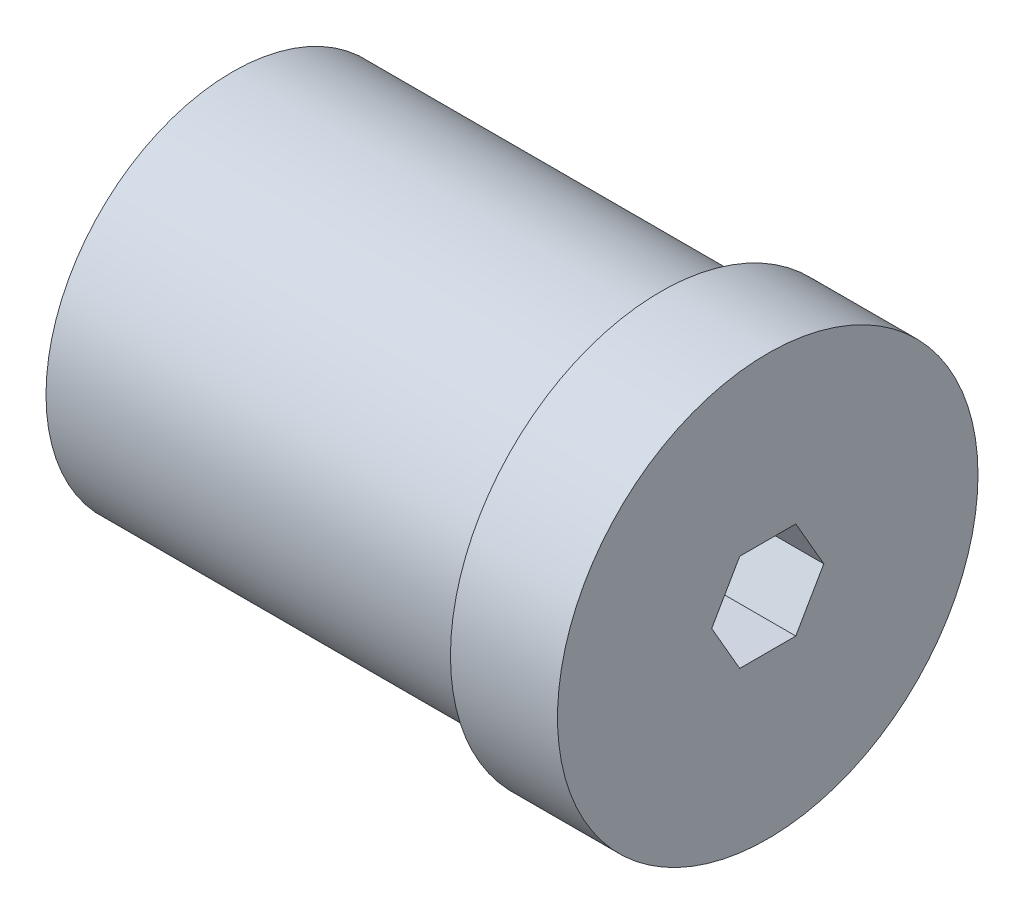
from build123d import *

# Parameters (mm, degrees)
CROQUIS1_R              = 24.4
SALIENTE_EXTRUIR1_DEPTH = 70
SALIENTE_EXTRUIR2_START = -4
CROQUIS2_R              = 27.5
CROQUIS2_R_2            = 24.4
SALIENTE_EXTRUIR2_DEPTH = 4
SALIENTE_EXTRUIR3_START = 10
CROQUIS3_R              = 27.5
CROQUIS3_R_2            = 25.4
SALIENTE_EXTRUIR3_DEPTH = 10


with BuildPart() as part:
    # Croquis1 → Saliente-Extruir1 (new body)
    with BuildSketch(Plane(origin=(0, 0, 0), x_dir=(0, 0, -1), z_dir=(1, 0, 0))):
        Circle(CROQUIS1_R)
        Polygon((7.332348419, 0), (3.666174209, 6.35), (-3.666174209, 6.35), (-7.332348419, 0), (-3.666174209, -6.35), (3.666174209, -6.35), align=None, mode=Mode.SUBTRACT)
    extrude(amount=SALIENTE_EXTRUIR1_DEPTH)

    # Croquis2 → Saliente-Extruir2 (add)
    with BuildSketch(Plane(origin=(70, 0, 0), x_dir=(0, 0, -1), z_dir=(1, 0, 0)).offset(SALIENTE_EXTRUIR2_START)):
        Circle(CROQUIS2_R)
        Circle(CROQUIS2_R_2, mode=Mode.SUBTRACT)
    extrude(amount=SALIENTE_EXTRUIR2_DEPTH)

    # Croquis3 → Saliente-Extruir3 (add)
    with BuildSketch(Plane.ZY.offset(-66).offset(SALIENTE_EXTRUIR3_START)):
        with Locations(Location((0, 0, 0), (0, 0, 180))):
            Circle(CROQUIS3_R)
        Circle(CROQUIS3_R_2, mode=Mode.SUBTRACT)
    extrude(amount=-SALIENTE_EXTRUIR3_DEPTH)


solid = part.part
